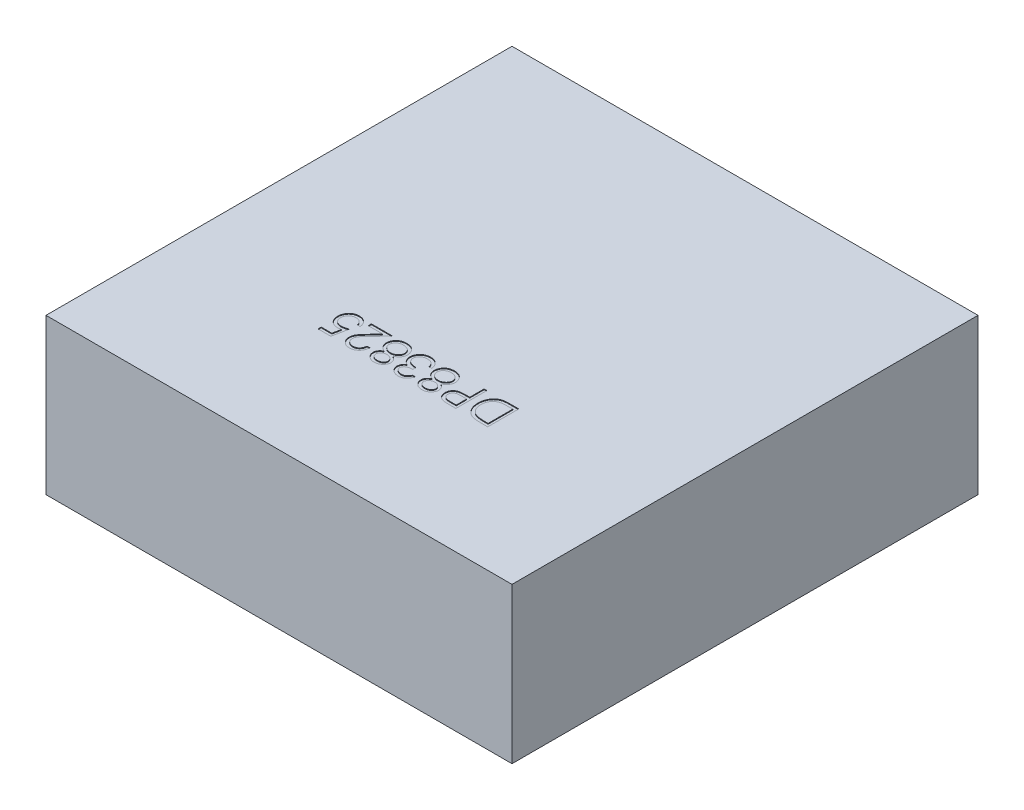
from build123d import *

# Parameters (mm, degrees)
BASES_W          = 3
BASES_H          = 3
BASE_DEPTH       = 1
PARTNUMBER_DEPTH = 0.005


with BuildPart() as part:
    # BaseS → Base (new body)
    with BuildSketch(Plane(origin=(0, 0, 0), x_dir=(1, 0, 0), z_dir=(0, 1, 0))):
        Rectangle(BASES_W, BASES_H)
    extrude(amount=BASE_DEPTH)

    # PartNumberS → PartNumber (cut)
    # profile 1 of 7: a face of its own
    with BuildSketch(Plane(origin=(0, 1, 0), x_dir=(1, 0, 0), z_dir=(0, 1, 0))):
        with BuildLine():
            Line((0.543589744, -0.5), (0.543589744, -0.7))
            Line((0.543589744, -0.7), (0.503205128, -0.7))
            add(Edge.make_bspline(
                [(0.503205128, -0.7), (0.499692607, -0.699974779), (0.492906435, -0.699926053), (0.483100107, -0.699615336), (0.474039691, -0.699071227), (0.46573033, -0.698263381), (0.458158677, -0.697293739), (0.451336857, -0.696060596), (0.445253815, -0.694610337), (0.441512712, -0.693373396), (0.43974359, -0.692788462)],
                knots=[0, 0, 0, 0, 1.314317071, 2.539253741, 3.67075822, 4.709970291, 5.662644612, 6.526156501, 7.303037452, 8, 8, 8, 8], degree=3))
            add(Edge.make_bspline(
                [(0.43974359, -0.692788462), (0.437429398, -0.691906981), (0.432853492, -0.690164008), (0.426341803, -0.686871104), (0.420190986, -0.683155356), (0.414449607, -0.678931575), (0.409105016, -0.674253735), (0.404089966, -0.669159683), (0.399548204, -0.663513427), (0.395323083, -0.657490166), (0.391625007, -0.651035088), (0.388364014, -0.644277488), (0.385579621, -0.637230477), (0.383407047, -0.629842637), (0.381612125, -0.622184924), (0.380407776, -0.614199361), (0.379607776, -0.605932503), (0.379527773, -0.600322461), (0.379487179, -0.597475962)],
                knots=[0, 0, 0, 0, 0.984696416, 1.947063185, 2.89840987, 3.841051395, 4.778753227, 5.721858861, 6.681155121, 7.65838316, 8.646299769, 9.637283673, 10.641736726, 11.657050558, 12.698485921, 13.768600492, 14.86780186, 16, 16, 16, 16], degree=3))
            add(Edge.make_bspline(
                [(0.379487179, -0.597475962), (0.379523145, -0.595003899), (0.379594018, -0.590132442), (0.380229632, -0.582952842), (0.381155261, -0.575986791), (0.382581759, -0.569264875), (0.384334606, -0.562741838), (0.386498066, -0.556448566), (0.389062316, -0.550380781), (0.392036117, -0.544586677), (0.395292309, -0.539080345), (0.398840463, -0.533949028), (0.402559095, -0.529136152), (0.40658383, -0.524750444), (0.410781412, -0.520655332), (0.415294606, -0.517032476), (0.419982101, -0.513713686), (0.424984721, -0.510799747), (0.430343511, -0.508207712), (0.436198451, -0.506018723), (0.442528171, -0.504134935), (0.449374613, -0.502634061), (0.456714945, -0.501424281), (0.464569063, -0.500618629), (0.472922261, -0.500072297), (0.478658238, -0.500024567), (0.481610577, -0.5)],
                knots=[0, 0, 0, 0, 1.105894396, 2.179280415, 3.222964075, 4.248423888, 5.251546139, 6.243661943, 7.223682738, 8.196462441, 9.155694589, 10.083899862, 10.986397372, 11.874737962, 12.745335529, 13.607670254, 14.461432187, 15.313100333, 16.195087267, 17.121790994, 18.106827133, 19.14775296, 20.255889161, 21.433815148, 22.679170477, 24, 24, 24, 24], degree=3))
            Line((0.481610577, -0.5), (0.543589744, -0.5))
        make_face()
        with BuildLine():
            Line((0.525641026, -0.520512821), (0.502684295, -0.520512821))
            add(Edge.make_bspline(
                [(0.502684295, -0.520512821), (0.499385531, -0.520526997), (0.493040799, -0.520554265), (0.483917485, -0.520793534), (0.47558152, -0.521184501), (0.468031719, -0.521731649), (0.461272346, -0.52245557), (0.455289275, -0.523262707), (0.450102117, -0.524268276), (0.446963292, -0.525179759), (0.445512821, -0.525600962)],
                knots=[0, 0, 0, 0, 1.375205317, 2.645023457, 3.804390687, 4.853969522, 5.800190428, 6.637939096, 7.370582563, 8, 8, 8, 8], degree=3))
            add(Edge.make_bspline(
                [(0.445512821, -0.525600962), (0.443687161, -0.52624386), (0.440079448, -0.5275143), (0.434886804, -0.529832576), (0.430041477, -0.532575274), (0.42546269, -0.535641994), (0.42117987, -0.539080089), (0.41721285, -0.542900492), (0.413530295, -0.547058974), (0.410191167, -0.551569547), (0.407171191, -0.556382165), (0.404561941, -0.561491465), (0.402362373, -0.566868777), (0.400557774, -0.572495393), (0.399150806, -0.57837466), (0.398160244, -0.584521333), (0.397546405, -0.590932984), (0.397473135, -0.595297753), (0.397435897, -0.597516026)],
                knots=[0, 0, 0, 0, 0.998420628, 1.972994, 2.929372424, 3.86770908, 4.81360496, 5.759023883, 6.706048443, 7.676227424, 8.651287839, 9.634325482, 10.632389399, 11.645655052, 12.680158286, 13.74837235, 14.855672678, 16, 16, 16, 16], degree=3))
            add(Edge.make_bspline(
                [(0.397435897, -0.597516026), (0.397465259, -0.599855068), (0.397522941, -0.604450136), (0.398246744, -0.61119266), (0.399306725, -0.61767655), (0.400831424, -0.623906472), (0.402801204, -0.629874323), (0.405158205, -0.635613817), (0.408019974, -0.641051094), (0.4112598, -0.646232204), (0.414897097, -0.651078684), (0.418915732, -0.655533753), (0.423273329, -0.659605711), (0.427949807, -0.663301041), (0.43301055, -0.666554027), (0.438369921, -0.669447832), (0.444103412, -0.671906581), (0.448092784, -0.673213849), (0.450120192, -0.673878205)],
                knots=[0, 0, 0, 0, 1.122272916, 2.204715076, 3.251197285, 4.274229216, 5.279697671, 6.265416158, 7.248880903, 8.225321784, 9.195852973, 10.153576302, 11.101466393, 12.055578741, 13.010401466, 13.985536859, 14.976245305, 16, 16, 16, 16], degree=3))
            add(Edge.make_bspline(
                [(0.450120192, -0.673878205), (0.451797401, -0.674342001), (0.455363606, -0.675328158), (0.461183004, -0.676403894), (0.467732441, -0.677352722), (0.475040995, -0.678156039), (0.483100336, -0.678732457), (0.491916661, -0.679165104), (0.501493781, -0.679456911), (0.508132783, -0.679476838), (0.511578526, -0.679487179)],
                knots=[0, 0, 0, 0, 0.674548936, 1.434276114, 2.292660221, 3.240891867, 4.284742987, 5.42552168, 6.663806718, 8, 8, 8, 8], degree=3))
            Line((0.511578526, -0.679487179), (0.525641026, -0.679487179))
            Line((0.525641026, -0.679487179), (0.525641026, -0.520512821))
        make_face(mode=Mode.SUBTRACT)
    # profile 2 of 7: a face of its own
    with BuildSketch(Plane(origin=(0, 1, 0), x_dir=(1, 0, 0), z_dir=(0, 1, 0))):
        with BuildLine():
            Line((0.338461538, -0.7), (0.299238782, -0.7))
            add(Edge.make_bspline(
                [(0.299238782, -0.7), (0.296541016, -0.699997035), (0.291371976, -0.699991352), (0.283959687, -0.699819081), (0.277227703, -0.699588985), (0.271190538, -0.699270019), (0.265829618, -0.698893071), (0.261169201, -0.698364383), (0.257172655, -0.697812366), (0.254778001, -0.697251143), (0.253685897, -0.696995192)],
                knots=[0, 0, 0, 0, 1.415646017, 2.712440637, 3.8905458, 4.950247383, 5.884950622, 6.709939814, 7.411656543, 8, 8, 8, 8], degree=3))
            add(Edge.make_bspline(
                [(0.253685897, -0.696995192), (0.252303419, -0.696616784), (0.249571037, -0.695868883), (0.245633708, -0.694371122), (0.241888245, -0.692594385), (0.238318984, -0.690572427), (0.234987068, -0.688209761), (0.231788469, -0.685642753), (0.228790266, -0.682767587), (0.226037732, -0.679588048), (0.22348739, -0.676208296), (0.221352571, -0.67254215), (0.219467441, -0.66871679), (0.217998343, -0.664638818), (0.216843575, -0.660362064), (0.216002557, -0.655875395), (0.215462016, -0.651188492), (0.215410725, -0.64798496), (0.215384615, -0.646354167)],
                knots=[0, 0, 0, 0, 0.999333726, 1.975119402, 2.933498163, 3.889020618, 4.832249799, 5.779334906, 6.747801194, 7.724875447, 8.710438469, 9.696133548, 10.679360639, 11.681339199, 12.714023775, 13.766351759, 14.862936069, 16, 16, 16, 16], degree=3))
            add(Edge.make_bspline(
                [(0.215384615, -0.646354167), (0.215408697, -0.644709722), (0.215455814, -0.641492256), (0.216021316, -0.636785239), (0.216783041, -0.632287046), (0.217954301, -0.628007648), (0.21948834, -0.623972462), (0.221287885, -0.62011982), (0.223458373, -0.616515267), (0.225952363, -0.613145717), (0.22872674, -0.610008008), (0.231769765, -0.607124877), (0.235069153, -0.604513201), (0.238614419, -0.602167124), (0.242440124, -0.600141051), (0.246488247, -0.598326348), (0.250793974, -0.596802287), (0.253773546, -0.596000569), (0.255288462, -0.595592949)],
                knots=[0, 0, 0, 0, 1.121902311, 2.195077645, 3.232258892, 4.234102512, 5.217864754, 6.176164875, 7.132989551, 8.084763148, 9.034132444, 9.988522005, 10.94243251, 11.903244335, 12.886203696, 13.894208494, 14.929344452, 16, 16, 16, 16], degree=3))
            add(Edge.make_bspline(
                [(0.255288462, -0.595592949), (0.256541466, -0.595326691), (0.259287499, -0.594743172), (0.263809657, -0.594087314), (0.269077464, -0.593549438), (0.275072997, -0.593047488), (0.281810237, -0.592781517), (0.289273732, -0.592469224), (0.297488742, -0.59232187), (0.303218455, -0.592312555), (0.306209936, -0.592307692)],
                knots=[0, 0, 0, 0, 0.601372724, 1.317943291, 2.144091499, 3.08771165, 4.142394186, 5.309582461, 6.595334295, 8, 8, 8, 8], degree=3))
            Line((0.306209936, -0.592307692), (0.320512821, -0.592307692))
            Line((0.320512821, -0.592307692), (0.320512821, -0.5))
            Line((0.320512821, -0.5), (0.338461538, -0.5))
            Line((0.338461538, -0.5), (0.338461538, -0.7))
        make_face()
        with BuildLine():
            Line((0.320512821, -0.679487179), (0.320512821, -0.612820513))
            Line((0.320512821, -0.612820513), (0.285496795, -0.612379808))
            add(Edge.make_bspline(
                [(0.285496795, -0.612379808), (0.283787056, -0.61237868), (0.28048644, -0.612376504), (0.275705726, -0.612608136), (0.271281004, -0.612860126), (0.267205742, -0.613267653), (0.26349854, -0.613764708), (0.260150423, -0.614429274), (0.25713467, -0.615107089), (0.253660857, -0.616283217), (0.249769822, -0.618057557), (0.245546671, -0.620707753), (0.241938335, -0.624046335), (0.238842209, -0.627840667), (0.236394934, -0.632066148), (0.234621287, -0.636574615), (0.233538689, -0.641348947), (0.233402616, -0.644612418), (0.233333333, -0.646274038)],
                knots=[0, 0, 0, 0, 1.160501667, 2.240324542, 3.248665471, 4.168823117, 5.020172044, 5.786515869, 6.485785279, 7.116517804, 8.272762037, 9.381837012, 10.485674779, 11.594342068, 12.695271952, 13.786226926, 14.872841088, 16, 16, 16, 16], degree=3))
            add(Edge.make_bspline(
                [(0.233333333, -0.646274038), (0.233405707, -0.647881827), (0.233549577, -0.651077912), (0.234612344, -0.655764279), (0.236413717, -0.660221491), (0.238844205, -0.664413482), (0.241866136, -0.668197729), (0.24540271, -0.671461906), (0.249398902, -0.674103874), (0.253087222, -0.675862608), (0.256387977, -0.676893968), (0.25924118, -0.677638558), (0.262479129, -0.678152086), (0.26607118, -0.678643436), (0.270012736, -0.679040062), (0.274328858, -0.679315492), (0.279005171, -0.679474996), (0.282251474, -0.67948302), (0.283934295, -0.679487179)],
                knots=[0, 0, 0, 0, 1.12039168, 2.227199994, 3.330242575, 4.460839274, 5.593542475, 6.693949254, 7.801736126, 8.92216649, 9.528704869, 10.210659466, 10.975987387, 11.81211542, 12.738540127, 13.736887663, 14.826846554, 16, 16, 16, 16], degree=3))
            Line((0.283934295, -0.679487179), (0.320512821, -0.679487179))
        make_face(mode=Mode.SUBTRACT)
    # profile 3 of 7: a face of its own
    with BuildSketch(Plane(origin=(0, 1, 0), x_dir=(1, 0, 0), z_dir=(0, 1, 0))):
        with BuildLine():
            add(Edge.make_bspline(
                [(0.095072115, -0.611418269), (0.093448086, -0.610564826), (0.09027078, -0.60889512), (0.085744586, -0.606198493), (0.081520102, -0.60345477), (0.077675464, -0.600565302), (0.074172977, -0.597591509), (0.071001864, -0.594541261), (0.068128021, -0.591424203), (0.065650177, -0.588160203), (0.063451692, -0.584807304), (0.061589306, -0.581324182), (0.059963915, -0.577761169), (0.058688187, -0.574064171), (0.057634926, -0.570283906), (0.056910765, -0.566369649), (0.056521184, -0.56234771), (0.056447543, -0.559629518), (0.056410256, -0.558253205)],
                knots=[0, 0, 0, 0, 1.264219729, 2.473363326, 3.62979159, 4.734286947, 5.785533755, 6.79450939, 7.765315851, 8.704182021, 9.615576613, 10.525715488, 11.423813905, 12.311666436, 13.218214638, 14.126256791, 15.051260205, 16, 16, 16, 16], degree=3))
            add(Edge.make_bspline(
                [(0.056410256, -0.558253205), (0.056454091, -0.556327537), (0.056540855, -0.552515919), (0.057304446, -0.546891633), (0.058432371, -0.54140719), (0.060145798, -0.536124764), (0.06225425, -0.530999346), (0.064914839, -0.52609999), (0.067917657, -0.521286058), (0.070332554, -0.518325141), (0.071554487, -0.516826923)],
                knots=[0, 0, 0, 0, 1.02531512, 2.029483338, 3.018748588, 4.004195107, 4.983200899, 5.966616707, 6.971112471, 8, 8, 8, 8], degree=3))
            add(Edge.make_bspline(
                [(0.071554487, -0.516826923), (0.073145143, -0.515078707), (0.076306798, -0.511603879), (0.081722965, -0.507092404), (0.087667073, -0.50330101), (0.094116121, -0.500211188), (0.101052869, -0.497806282), (0.108475841, -0.496078138), (0.116399507, -0.495088285), (0.121845534, -0.4949452), (0.124639423, -0.494871795)],
                knots=[0, 0, 0, 0, 0.954267603, 1.896743057, 2.838368354, 3.796610408, 4.779680527, 5.799409237, 6.871065594, 8, 8, 8, 8], degree=3))
            add(Edge.make_bspline(
                [(0.124639423, -0.494871795), (0.127325841, -0.494937827), (0.132553336, -0.49506632), (0.140163209, -0.49593214), (0.147265419, -0.497464973), (0.153893637, -0.499519585), (0.159983771, -0.502259459), (0.165546895, -0.505617745), (0.170664546, -0.509518623), (0.175176177, -0.514055973), (0.179180498, -0.518916859), (0.182701081, -0.523930136), (0.185610833, -0.529092156), (0.188118805, -0.534324398), (0.189985223, -0.539732879), (0.19130901, -0.545262095), (0.192140532, -0.550896339), (0.192251744, -0.554698039), (0.192307692, -0.556610577)],
                knots=[0, 0, 0, 0, 1.256864279, 2.445730223, 3.576845088, 4.651810441, 5.686528262, 6.692706664, 7.686234615, 8.689148594, 9.678739427, 10.630299996, 11.55097961, 12.448208961, 13.341360817, 14.221834469, 15.105450545, 16, 16, 16, 16], degree=3))
            add(Edge.make_bspline(
                [(0.192307692, -0.556610577), (0.192274662, -0.558013956), (0.192209384, -0.560787529), (0.191757795, -0.56488525), (0.191031164, -0.568873432), (0.190046512, -0.572767815), (0.188699829, -0.57654785), (0.187102182, -0.580233033), (0.185221368, -0.583823256), (0.182983326, -0.587263859), (0.180517583, -0.590676716), (0.177590521, -0.593892364), (0.174397283, -0.597099685), (0.170747775, -0.600103642), (0.166839098, -0.603152404), (0.162488961, -0.605991149), (0.157842414, -0.608841427), (0.15453909, -0.610544584), (0.152844551, -0.611418269)],
                knots=[0, 0, 0, 0, 0.941575622, 1.860885767, 2.762557628, 3.660168386, 4.552890429, 5.45184204, 6.353736508, 7.268493418, 8.204037487, 9.175167802, 10.182660057, 11.238220596, 12.344046335, 13.507168087, 14.721227736, 16, 16, 16, 16], degree=3))
            add(Edge.make_bspline(
                [(0.152844551, -0.611418269), (0.155161235, -0.612686787), (0.159639967, -0.615139152), (0.165626949, -0.619588623), (0.170698429, -0.624494994), (0.174800511, -0.629865647), (0.178039312, -0.635524067), (0.180329181, -0.641440467), (0.181823831, -0.647548858), (0.181975241, -0.651714174), (0.182051282, -0.65380609)],
                knots=[0, 0, 0, 0, 1.16701039, 2.256125286, 3.287752239, 4.277689688, 5.235169525, 6.160862735, 7.076343936, 8, 8, 8, 8], degree=3))
            add(Edge.make_bspline(
                [(0.182051282, -0.65380609), (0.181957663, -0.65593728), (0.181769474, -0.660221345), (0.180252979, -0.666600352), (0.177762975, -0.672868993), (0.17443421, -0.679012741), (0.170197946, -0.68475165), (0.165183735, -0.68994045), (0.159397884, -0.694444849), (0.152967566, -0.698252547), (0.146060008, -0.701366404), (0.138759626, -0.703492187), (0.131196531, -0.704890317), (0.126047994, -0.705048169), (0.1234375, -0.705128205)],
                knots=[0, 0, 0, 0, 0.888724595, 1.786491426, 2.720083884, 3.697804067, 4.69440576, 5.687697823, 6.7000873, 7.744853364, 8.800284131, 9.853047784, 10.91141782, 12, 12, 12, 12], degree=3))
            add(Edge.make_bspline(
                [(0.1234375, -0.705128205), (0.12089433, -0.705045914), (0.115879488, -0.704883645), (0.108497178, -0.703516914), (0.101427646, -0.701259841), (0.094710514, -0.698185699), (0.088488708, -0.694355228), (0.082951877, -0.689801259), (0.078054821, -0.684668997), (0.074008968, -0.67891116), (0.07076334, -0.672767821), (0.068426113, -0.666395151), (0.0669485, -0.659869548), (0.066760739, -0.65545632), (0.066666667, -0.653245192)],
                knots=[0, 0, 0, 0, 1.072634126, 2.115112298, 3.156050586, 4.19761425, 5.225177188, 6.230426315, 7.215180151, 8.209739481, 9.190420596, 10.139012357, 11.067603024, 12, 12, 12, 12], degree=3))
            add(Edge.make_bspline(
                [(0.066666667, -0.653245192), (0.066749137, -0.651075288), (0.066911105, -0.646813718), (0.068255664, -0.640610289), (0.070555277, -0.63481268), (0.073657461, -0.629331678), (0.077729149, -0.62425487), (0.082688129, -0.619557042), (0.088470053, -0.615146315), (0.092822236, -0.612688729), (0.095072115, -0.611418269)],
                knots=[0, 0, 0, 0, 0.975463758, 1.915755378, 2.838359076, 3.772025586, 4.738400888, 5.753889765, 6.838863581, 8, 8, 8, 8], degree=3))
        make_face()
        with BuildLine():
            add(Edge.make_bspline(
                [(0.124439103, -0.684615385), (0.125842055, -0.68457828), (0.128586843, -0.684505687), (0.132610652, -0.684123506), (0.136440115, -0.683389395), (0.140096173, -0.682383673), (0.143591352, -0.681132354), (0.146845499, -0.679483698), (0.149967974, -0.67765121), (0.152856339, -0.675501785), (0.155471044, -0.673156716), (0.157806436, -0.670707661), (0.159709055, -0.668082423), (0.161345949, -0.665412338), (0.162561571, -0.662586659), (0.163425107, -0.659667255), (0.164036238, -0.656635634), (0.164080284, -0.654570362), (0.164102564, -0.653525641)],
                knots=[0, 0, 0, 0, 1.20353747, 2.354645537, 3.462130888, 4.543058862, 5.604822423, 6.639552563, 7.666902586, 8.706944258, 9.720926464, 10.677177239, 11.602682187, 12.496457588, 13.358248655, 14.231532794, 15.105417644, 16, 16, 16, 16], degree=3))
            add(Edge.make_bspline(
                [(0.164102564, -0.653525641), (0.16406193, -0.652481511), (0.16398163, -0.65041816), (0.163400418, -0.647358955), (0.162428627, -0.644391821), (0.161096092, -0.641489058), (0.159386034, -0.638658118), (0.157310533, -0.635888153), (0.154779535, -0.633252413), (0.15198455, -0.630676115), (0.148931523, -0.628302534), (0.145723347, -0.626182322), (0.142336608, -0.624492107), (0.138872732, -0.623010134), (0.135258466, -0.621898483), (0.13151873, -0.621097603), (0.127657519, -0.620602209), (0.125041531, -0.620542853), (0.123717949, -0.620512821)],
                knots=[0, 0, 0, 0, 0.873213166, 1.72559466, 2.594724523, 3.479581045, 4.391597569, 5.35687048, 6.368548091, 7.443976143, 8.534559525, 9.600545123, 10.654815915, 11.696401765, 12.749428718, 13.812189468, 14.893058657, 16, 16, 16, 16], degree=3))
            add(Edge.make_bspline(
                [(0.123717949, -0.620512821), (0.122017841, -0.620562447), (0.118634417, -0.62066121), (0.113648532, -0.621587854), (0.108788446, -0.623027019), (0.10414612, -0.625069654), (0.099804641, -0.627560117), (0.095886456, -0.630497069), (0.092555535, -0.633949484), (0.089721768, -0.637717094), (0.087506164, -0.641713618), (0.085808977, -0.645740643), (0.084809483, -0.649831338), (0.084679557, -0.652572418), (0.084615385, -0.653926282)],
                knots=[0, 0, 0, 0, 1.076561449, 2.142489767, 3.202892658, 4.283174188, 5.348766409, 6.369549039, 7.375093932, 8.378927502, 9.349008457, 10.26378795, 11.142457041, 12, 12, 12, 12], degree=3))
            add(Edge.make_bspline(
                [(0.084615385, -0.653926282), (0.084645217, -0.654876655), (0.084704429, -0.656763008), (0.085212138, -0.659557766), (0.086004009, -0.662290685), (0.087158273, -0.664945724), (0.088554573, -0.667584561), (0.090334402, -0.670124414), (0.092397123, -0.672642144), (0.094772513, -0.675054881), (0.097456214, -0.677320023), (0.100469934, -0.679283546), (0.10378708, -0.680920906), (0.107363178, -0.682296491), (0.111236022, -0.683318149), (0.115372266, -0.684086984), (0.119809232, -0.684519435), (0.12286234, -0.684582708), (0.124439103, -0.684615385)],
                knots=[0, 0, 0, 0, 0.814035228, 1.61574325, 2.427118093, 3.24780647, 4.092880925, 4.981933388, 5.900917883, 6.880367106, 7.87994501, 8.905470125, 9.95492938, 11.0455354, 12.184050453, 13.382997595, 14.64846247, 16, 16, 16, 16], degree=3))
        make_face(mode=Mode.SUBTRACT)
        with BuildLine():
            add(Edge.make_bspline(
                [(0.123277244, -0.6), (0.125055855, -0.599968354), (0.128545057, -0.599906273), (0.13365695, -0.599215573), (0.138562594, -0.598253427), (0.143246929, -0.596796207), (0.147685909, -0.594900166), (0.151942005, -0.592651786), (0.155948568, -0.58995688), (0.159687689, -0.586880797), (0.163110956, -0.58354732), (0.166125189, -0.580026723), (0.168671789, -0.576366811), (0.170738384, -0.572562955), (0.172341593, -0.568623537), (0.173524787, -0.564546257), (0.174211747, -0.560319741), (0.174309625, -0.557454335), (0.174358974, -0.556009615)],
                knots=[0, 0, 0, 0, 1.140332253, 2.237053636, 3.304055028, 4.344690294, 5.377465719, 6.397042765, 7.428360044, 8.469453732, 9.499453352, 10.490108612, 11.438398528, 12.354680514, 13.261581007, 14.161901135, 15.073242693, 16, 16, 16, 16], degree=3))
            add(Edge.make_bspline(
                [(0.174358974, -0.556009615), (0.174279634, -0.554213877), (0.174121649, -0.550638134), (0.17291325, -0.545366854), (0.17092871, -0.540265191), (0.168144634, -0.535405096), (0.164748712, -0.530845496), (0.160620307, -0.526815098), (0.155860072, -0.523368157), (0.150507117, -0.520487221), (0.14463923, -0.518205481), (0.138292673, -0.516573052), (0.131510437, -0.515547001), (0.12683336, -0.515439597), (0.124439103, -0.515384615)],
                knots=[0, 0, 0, 0, 0.899105568, 1.790333855, 2.694925079, 3.632758987, 4.588257081, 5.534574046, 6.511571685, 7.523527334, 8.572244311, 9.657983075, 10.801090915, 12, 12, 12, 12], degree=3))
            add(Edge.make_bspline(
                [(0.124439103, -0.515384615), (0.122567783, -0.515420967), (0.118921852, -0.515491791), (0.113600858, -0.51610394), (0.108591274, -0.51710387), (0.103845107, -0.518459669), (0.099397684, -0.520256898), (0.095255066, -0.52248923), (0.091360842, -0.525039034), (0.087881445, -0.528057783), (0.084717817, -0.531288031), (0.081946728, -0.534689588), (0.079601535, -0.538228389), (0.077711084, -0.541902361), (0.076209885, -0.545698003), (0.075127692, -0.549630896), (0.074460706, -0.553716489), (0.074393195, -0.556487844), (0.074358974, -0.557892628)],
                knots=[0, 0, 0, 0, 1.224631902, 2.385975653, 3.500340538, 4.565441647, 5.612488581, 6.63322211, 7.641830068, 8.652595074, 9.641693811, 10.598750962, 11.520088299, 12.415429315, 13.298523938, 14.187139574, 15.081071174, 16, 16, 16, 16], degree=3))
            add(Edge.make_bspline(
                [(0.074358974, -0.557892628), (0.074410395, -0.559257203), (0.074511788, -0.561947906), (0.075164559, -0.565932312), (0.07628515, -0.569797522), (0.077919162, -0.573526106), (0.079925811, -0.577161434), (0.082404663, -0.580672989), (0.085325505, -0.584070494), (0.088681189, -0.587283997), (0.092317992, -0.590254735), (0.09617221, -0.592894765), (0.100261406, -0.595052486), (0.104504576, -0.596865123), (0.108944495, -0.598277723), (0.113559747, -0.599268256), (0.118359076, -0.599890806), (0.121619333, -0.599963191), (0.123277244, -0.6)],
                knots=[0, 0, 0, 0, 0.917336384, 1.808827106, 2.706624561, 3.615530867, 4.539869921, 5.493819324, 6.499753197, 7.547410123, 8.613069608, 9.653934021, 10.682176708, 11.716048074, 12.752411263, 13.808993382, 14.885826486, 16, 16, 16, 16], degree=3))
        make_face(mode=Mode.SUBTRACT)
    # profile 4 of 7: a face of its own
    with BuildSketch(Plane(origin=(0, 1, 0), x_dir=(1, 0, 0), z_dir=(0, 1, 0))):
        with BuildLine():
            Line((0.012820513, -0.653846154), (0.030769231, -0.653846154))
            add(Edge.make_bspline(
                [(0.030769231, -0.653846154), (0.030282971, -0.655859439), (0.029332372, -0.659795246), (0.027349654, -0.665418518), (0.025189696, -0.670739862), (0.022596033, -0.675659638), (0.019766961, -0.680276718), (0.016525663, -0.684486382), (0.013021679, -0.688395694), (0.009145968, -0.691865022), (0.005081473, -0.695006607), (0.000770923, -0.697685181), (-0.003698957, -0.699989419), (-0.008359136, -0.701887718), (-0.013223488, -0.703317748), (-0.018248038, -0.704355279), (-0.023445953, -0.705029057), (-0.026974386, -0.705094815), (-0.028766026, -0.705128205)],
                knots=[0, 0, 0, 0, 1.162005537, 2.271625781, 3.343758855, 4.383309926, 5.390229558, 6.379919256, 7.361854164, 8.333198761, 9.295911338, 10.242430842, 11.177959212, 12.116337295, 13.062827104, 14.020064771, 14.994644689, 16, 16, 16, 16], degree=3))
            add(Edge.make_bspline(
                [(-0.028766026, -0.705128205), (-0.031376468, -0.705049392), (-0.036540412, -0.704893485), (-0.044126871, -0.703469803), (-0.05144269, -0.701216938), (-0.058407789, -0.698104154), (-0.064877414, -0.694264879), (-0.070633768, -0.689695465), (-0.075598825, -0.684484076), (-0.079764218, -0.67872793), (-0.083025647, -0.672576186), (-0.085430583, -0.666244749), (-0.086894679, -0.659748636), (-0.087084425, -0.655362506), (-0.087179487, -0.653165064)],
                knots=[0, 0, 0, 0, 1.083050992, 2.142477498, 3.193116406, 4.255571735, 5.30263384, 6.308962982, 7.297363603, 8.282367274, 9.249857812, 10.179914175, 11.08814088, 12, 12, 12, 12], degree=3))
            add(Edge.make_bspline(
                [(-0.087179487, -0.653165064), (-0.087112996, -0.65105039), (-0.086982884, -0.646912301), (-0.085878101, -0.640871073), (-0.084018886, -0.635177267), (-0.081443471, -0.629806915), (-0.078109668, -0.624794067), (-0.074071228, -0.620127445), (-0.069299647, -0.61578635), (-0.065683708, -0.613299523), (-0.063822115, -0.612019231)],
                knots=[0, 0, 0, 0, 1.024540389, 2.004866551, 2.965041327, 3.920577974, 4.882998113, 5.874504559, 6.905732034, 8, 8, 8, 8], degree=3))
            add(Edge.make_bspline(
                [(-0.063822115, -0.612019231), (-0.065952356, -0.610995631), (-0.070179819, -0.608964297), (-0.0758839, -0.604917242), (-0.081140957, -0.600359254), (-0.084038259, -0.596762548), (-0.085496795, -0.594951923)],
                knots=[0, 0, 0, 0, 1.015663554, 2.015584519, 3.001021554, 4, 4, 4, 4], degree=3))
            add(Edge.make_bspline(
                [(-0.085496795, -0.594951923), (-0.086459549, -0.593634478), (-0.088369292, -0.591021161), (-0.090719885, -0.586817028), (-0.092876712, -0.582580215), (-0.094464075, -0.578144135), (-0.095833906, -0.573651284), (-0.09673521, -0.569005451), (-0.09731381, -0.564250776), (-0.097395058, -0.561032679), (-0.097435897, -0.559415064)],
                knots=[0, 0, 0, 0, 1.02516404, 2.033540309, 3.025129118, 4.011046665, 4.991655828, 5.976607087, 6.982917762, 8, 8, 8, 8], degree=3))
            add(Edge.make_bspline(
                [(-0.097435897, -0.559415064), (-0.097333113, -0.556614634), (-0.097128029, -0.551026954), (-0.095302832, -0.54276937), (-0.092455757, -0.534712452), (-0.088487886, -0.526970463), (-0.083556422, -0.519748905), (-0.07772183, -0.513268976), (-0.070977897, -0.507749819), (-0.063520977, -0.503097513), (-0.055410893, -0.499410613), (-0.046770987, -0.496753903), (-0.037652414, -0.49516025), (-0.031416635, -0.494969041), (-0.028245192, -0.494871795)],
                knots=[0, 0, 0, 0, 0.955619592, 1.906742024, 2.874954321, 3.868585453, 4.869520953, 5.854611167, 6.836527075, 7.836578462, 8.849204403, 9.870874567, 10.917152508, 12, 12, 12, 12], degree=3))
            add(Edge.make_bspline(
                [(-0.028245192, -0.494871795), (-0.026107081, -0.49492184), (-0.021899991, -0.495020311), (-0.015712732, -0.495681497), (-0.009819218, -0.496921931), (-0.004162223, -0.498481947), (0.001172877, -0.500638844), (0.006262821, -0.503210266), (0.0110853, -0.506262151), (0.015611673, -0.509799634), (0.019837104, -0.513759317), (0.023653945, -0.518206982), (0.027104423, -0.523059619), (0.030166616, -0.52836088), (0.03285341, -0.534095915), (0.035106986, -0.540287707), (0.037074636, -0.546888254), (0.037991249, -0.551486777), (0.038461538, -0.553846154)],
                knots=[0, 0, 0, 0, 1.048603596, 2.063302207, 3.045874044, 3.999447474, 4.937100059, 5.862643889, 6.7929026, 7.7308982, 8.676022965, 9.627908155, 10.600123445, 11.591992905, 12.626222643, 13.701663232, 14.820785756, 16, 16, 16, 16], degree=3))
            Line((0.038461538, -0.553846154), (0.020512821, -0.553846154))
            add(Edge.make_bspline(
                [(0.020512821, -0.553846154), (0.020045204, -0.55230621), (0.019135649, -0.549310886), (0.017587403, -0.545000012), (0.015823502, -0.541048123), (0.013931241, -0.53742623), (0.011943902, -0.534098664), (0.009720192, -0.531153415), (0.007424812, -0.528461117), (0.005694563, -0.526944282), (0.004847756, -0.526201923)],
                knots=[0, 0, 0, 0, 1.198163088, 2.33053128, 3.407730985, 4.417276592, 5.372219308, 6.28897303, 7.162600585, 8, 8, 8, 8], degree=3))
            add(Edge.make_bspline(
                [(0.004847756, -0.526201923), (0.003727827, -0.525338946), (0.001491425, -0.523615655), (-0.002150597, -0.521410219), (-0.005994289, -0.519522419), (-0.010071706, -0.517987935), (-0.014383394, -0.516836097), (-0.018911864, -0.516007058), (-0.023664545, -0.515459763), (-0.026908156, -0.51541003), (-0.028565705, -0.515384615)],
                knots=[0, 0, 0, 0, 0.946083416, 1.889246487, 2.84504177, 3.809995578, 4.801312957, 5.829064617, 6.89060985, 8, 8, 8, 8], degree=3))
            add(Edge.make_bspline(
                [(-0.028565705, -0.515384615), (-0.030437359, -0.515419753), (-0.034097217, -0.515488461), (-0.039437141, -0.516122158), (-0.044518831, -0.517041039), (-0.049290429, -0.518478347), (-0.053816865, -0.520202635), (-0.057997096, -0.522460045), (-0.061954014, -0.525009425), (-0.065571702, -0.527974844), (-0.068833224, -0.531180141), (-0.071651539, -0.534580675), (-0.074092522, -0.538071008), (-0.076054666, -0.541732562), (-0.077606813, -0.545529421), (-0.078662813, -0.549475795), (-0.079397234, -0.553538455), (-0.079457034, -0.556300116), (-0.079487179, -0.557692308)],
                knots=[0, 0, 0, 0, 1.216990249, 2.379719373, 3.493992396, 4.571561497, 5.616923107, 6.638958652, 7.655775068, 8.674704564, 9.676001865, 10.625896028, 11.54399481, 12.441854662, 13.322657739, 14.20572845, 15.095482574, 16, 16, 16, 16], degree=3))
            add(Edge.make_bspline(
                [(-0.079487179, -0.557692308), (-0.079399551, -0.559555696), (-0.079224731, -0.5632732), (-0.077895545, -0.568744529), (-0.075689671, -0.574018171), (-0.072661586, -0.579025064), (-0.068887132, -0.583611196), (-0.064544725, -0.58771628), (-0.059541713, -0.591134393), (-0.054910874, -0.593489428), (-0.050798365, -0.595058495), (-0.047286074, -0.596158774), (-0.043350443, -0.597038296), (-0.03903876, -0.597889066), (-0.034332829, -0.598602295), (-0.029228414, -0.599199653), (-0.02372346, -0.599676883), (-0.019912544, -0.599890117), (-0.017948718, -0.6)],
                knots=[0, 0, 0, 0, 1.070440979, 2.135555593, 3.216243406, 4.345886539, 5.486149072, 6.621334998, 7.769144672, 8.957074012, 9.598644492, 10.297969361, 11.070758978, 11.915404831, 12.824182859, 13.805940418, 14.869366021, 16, 16, 16, 16], degree=3))
            Line((-0.017948718, -0.6), (-0.017948718, -0.620512821))
            add(Edge.make_bspline(
                [(-0.017948718, -0.620512821), (-0.020422108, -0.620561043), (-0.025265177, -0.620655467), (-0.03235955, -0.62156233), (-0.039122704, -0.623034295), (-0.045452911, -0.625089351), (-0.051192825, -0.627591218), (-0.056220175, -0.630392354), (-0.060354102, -0.633623909), (-0.063668643, -0.637133123), (-0.066127074, -0.640920736), (-0.067941743, -0.644850479), (-0.069015081, -0.648995461), (-0.06915862, -0.651823627), (-0.069230769, -0.653245192)],
                knots=[0, 0, 0, 0, 1.321816535, 2.58820849, 3.816448615, 5.017641336, 6.139869627, 7.160068286, 8.085608132, 8.934319198, 9.728416342, 10.48890201, 11.240453369, 12, 12, 12, 12], degree=3))
            add(Edge.make_bspline(
                [(-0.069230769, -0.653245192), (-0.06920761, -0.654289811), (-0.069161535, -0.656368031), (-0.068557263, -0.659413745), (-0.067691186, -0.662366392), (-0.066432952, -0.665191473), (-0.064805673, -0.667897968), (-0.062836907, -0.670495763), (-0.060521668, -0.673009663), (-0.05787499, -0.675384225), (-0.05492123, -0.677521373), (-0.051778939, -0.679426611), (-0.048435869, -0.681028645), (-0.044913803, -0.682356622), (-0.041193704, -0.683353822), (-0.037295143, -0.684070288), (-0.033210105, -0.684518117), (-0.030423153, -0.684582603), (-0.02900641, -0.684615385)],
                knots=[0, 0, 0, 0, 0.884246871, 1.759167212, 2.622361933, 3.489113179, 4.372562419, 5.294145153, 6.247651513, 7.265905295, 8.30305477, 9.334068495, 10.37719476, 11.441246459, 12.52060732, 13.637552802, 14.799054011, 16, 16, 16, 16], degree=3))
            add(Edge.make_bspline(
                [(-0.02900641, -0.684615385), (-0.026729097, -0.684536032), (-0.022280974, -0.684381039), (-0.015869742, -0.683018718), (-0.009915786, -0.680860261), (-0.005380072, -0.678253931), (-0.002025058, -0.67569), (0.000418369, -0.67348425), (0.002774082, -0.670983381), (0.004949643, -0.668118798), (0.007075414, -0.664989002), (0.009131098, -0.661576754), (0.011050666, -0.657833407), (0.012219139, -0.655200978), (0.012820513, -0.653846154)],
                knots=[0, 0, 0, 0, 1.4727372, 2.876598283, 4.222346151, 5.558423782, 6.24313385, 6.953189256, 7.68715613, 8.463578749, 9.278833271, 10.135787152, 11.040551781, 12, 12, 12, 12], degree=3))
        make_face()
    # profile 5 of 7: a face of its own
    with BuildSketch(Plane(origin=(0, 1, 0), x_dir=(1, 0, 0), z_dir=(0, 1, 0))):
        with BuildLine():
            add(Edge.make_bspline(
                [(-0.212620192, -0.611418269), (-0.214244221, -0.610564826), (-0.217421528, -0.60889512), (-0.221947722, -0.606198493), (-0.226172205, -0.60345477), (-0.230016844, -0.600565302), (-0.233519331, -0.597591509), (-0.236690444, -0.594541261), (-0.239564287, -0.591424203), (-0.242042131, -0.588160203), (-0.244240616, -0.584807304), (-0.246103002, -0.581324182), (-0.247728392, -0.577761169), (-0.249004121, -0.574064171), (-0.250057382, -0.570283906), (-0.250781543, -0.566369649), (-0.251171124, -0.56234771), (-0.251244765, -0.559629518), (-0.251282051, -0.558253205)],
                knots=[0, 0, 0, 0, 1.264219729, 2.473363326, 3.62979159, 4.734286947, 5.785533755, 6.79450939, 7.765315851, 8.704182021, 9.615576613, 10.525715488, 11.423813905, 12.311666436, 13.218214638, 14.126256791, 15.051260205, 16, 16, 16, 16], degree=3))
            add(Edge.make_bspline(
                [(-0.251282051, -0.558253205), (-0.251238217, -0.556327537), (-0.251151453, -0.552515919), (-0.250387862, -0.546891633), (-0.249259937, -0.54140719), (-0.24754651, -0.536124764), (-0.245438058, -0.530999346), (-0.242777469, -0.52609999), (-0.23977465, -0.521286058), (-0.237359753, -0.518325141), (-0.236137821, -0.516826923)],
                knots=[0, 0, 0, 0, 1.02531512, 2.029483338, 3.018748588, 4.004195107, 4.983200899, 5.966616707, 6.971112471, 8, 8, 8, 8], degree=3))
            add(Edge.make_bspline(
                [(-0.236137821, -0.516826923), (-0.234547165, -0.515078707), (-0.23138551, -0.511603879), (-0.225969342, -0.507092404), (-0.220025235, -0.50330101), (-0.213576187, -0.500211188), (-0.206639438, -0.497806282), (-0.199216467, -0.496078138), (-0.191292801, -0.495088285), (-0.185846774, -0.4949452), (-0.183052885, -0.494871795)],
                knots=[0, 0, 0, 0, 0.954267603, 1.896743057, 2.838368354, 3.796610408, 4.779680527, 5.799409237, 6.871065594, 8, 8, 8, 8], degree=3))
            add(Edge.make_bspline(
                [(-0.183052885, -0.494871795), (-0.180366467, -0.494937827), (-0.175138972, -0.49506632), (-0.167529098, -0.49593214), (-0.160426889, -0.497464973), (-0.153798671, -0.499519585), (-0.147708536, -0.502259459), (-0.142145413, -0.505617745), (-0.137027762, -0.509518623), (-0.132516131, -0.514055973), (-0.12851181, -0.518916859), (-0.124991226, -0.523930136), (-0.122081475, -0.529092156), (-0.119573503, -0.534324398), (-0.117707085, -0.539732879), (-0.116383298, -0.545262095), (-0.115551775, -0.550896339), (-0.115440563, -0.554698039), (-0.115384615, -0.556610577)],
                knots=[0, 0, 0, 0, 1.256864279, 2.445730223, 3.576845088, 4.651810441, 5.686528262, 6.692706664, 7.686234615, 8.689148594, 9.678739427, 10.630299996, 11.55097961, 12.448208961, 13.341360817, 14.221834469, 15.105450545, 16, 16, 16, 16], degree=3))
            add(Edge.make_bspline(
                [(-0.115384615, -0.556610577), (-0.115417645, -0.558013956), (-0.115482924, -0.560787529), (-0.115934513, -0.56488525), (-0.116661144, -0.568873432), (-0.117645796, -0.572767815), (-0.118992479, -0.57654785), (-0.120590126, -0.580233033), (-0.12247094, -0.583823256), (-0.124708982, -0.587263859), (-0.127174724, -0.590676716), (-0.130101787, -0.593892364), (-0.133295025, -0.597099685), (-0.136944533, -0.600103642), (-0.140853209, -0.603152404), (-0.145203347, -0.605991149), (-0.149849894, -0.608841427), (-0.153153218, -0.610544584), (-0.154847756, -0.611418269)],
                knots=[0, 0, 0, 0, 0.941575622, 1.860885767, 2.762557628, 3.660168386, 4.552890429, 5.45184204, 6.353736508, 7.268493418, 8.204037487, 9.175167802, 10.182660057, 11.238220596, 12.344046335, 13.507168087, 14.721227736, 16, 16, 16, 16], degree=3))
            add(Edge.make_bspline(
                [(-0.154847756, -0.611418269), (-0.152531073, -0.612686787), (-0.14805234, -0.615139152), (-0.142065358, -0.619588623), (-0.136993879, -0.624494994), (-0.132891797, -0.629865647), (-0.129652996, -0.635524067), (-0.127363126, -0.641440467), (-0.125868476, -0.647548858), (-0.125717067, -0.651714174), (-0.125641026, -0.65380609)],
                knots=[0, 0, 0, 0, 1.16701039, 2.256125286, 3.287752239, 4.277689688, 5.235169525, 6.160862735, 7.076343936, 8, 8, 8, 8], degree=3))
            add(Edge.make_bspline(
                [(-0.125641026, -0.65380609), (-0.125734644, -0.65593728), (-0.125922834, -0.660221345), (-0.127439328, -0.666600352), (-0.129929333, -0.672868993), (-0.133258097, -0.679012741), (-0.137494362, -0.68475165), (-0.142508573, -0.68994045), (-0.148294424, -0.694444849), (-0.154724742, -0.698252547), (-0.1616323, -0.701366404), (-0.168932682, -0.703492187), (-0.176495776, -0.704890317), (-0.181644314, -0.705048169), (-0.184254808, -0.705128205)],
                knots=[0, 0, 0, 0, 0.888724595, 1.786491426, 2.720083884, 3.697804067, 4.69440576, 5.687697823, 6.7000873, 7.744853364, 8.800284131, 9.853047784, 10.91141782, 12, 12, 12, 12], degree=3))
            add(Edge.make_bspline(
                [(-0.184254808, -0.705128205), (-0.186797978, -0.705045914), (-0.191812819, -0.704883645), (-0.19919513, -0.703516914), (-0.206264662, -0.701259841), (-0.212981794, -0.698185699), (-0.2192036, -0.694355228), (-0.224740431, -0.689801259), (-0.229637487, -0.684668997), (-0.23368334, -0.67891116), (-0.236928968, -0.672767821), (-0.239266194, -0.666395151), (-0.240743808, -0.659869548), (-0.240931569, -0.65545632), (-0.241025641, -0.653245192)],
                knots=[0, 0, 0, 0, 1.072634126, 2.115112298, 3.156050586, 4.19761425, 5.225177188, 6.230426315, 7.215180151, 8.209739481, 9.190420596, 10.139012357, 11.067603024, 12, 12, 12, 12], degree=3))
            add(Edge.make_bspline(
                [(-0.241025641, -0.653245192), (-0.24094317, -0.651075288), (-0.240781202, -0.646813718), (-0.239436644, -0.640610289), (-0.237137031, -0.63481268), (-0.234034847, -0.629331678), (-0.229963159, -0.62425487), (-0.225004178, -0.619557042), (-0.219222254, -0.615146315), (-0.214870072, -0.612688729), (-0.212620192, -0.611418269)],
                knots=[0, 0, 0, 0, 0.975463758, 1.915755378, 2.838359076, 3.772025586, 4.738400888, 5.753889765, 6.838863581, 8, 8, 8, 8], degree=3))
        make_face()
        with BuildLine():
            add(Edge.make_bspline(
                [(-0.183253205, -0.684615385), (-0.181850253, -0.68457828), (-0.179105465, -0.684505687), (-0.175081656, -0.684123506), (-0.171252193, -0.683389395), (-0.167596134, -0.682383673), (-0.164100956, -0.681132354), (-0.160846808, -0.679483698), (-0.157724334, -0.67765121), (-0.154835968, -0.675501785), (-0.152221264, -0.673156716), (-0.149885872, -0.670707661), (-0.147983252, -0.668082423), (-0.146346359, -0.665412338), (-0.145130737, -0.662586659), (-0.144267201, -0.659667255), (-0.14365607, -0.656635634), (-0.143612024, -0.654570362), (-0.143589744, -0.653525641)],
                knots=[0, 0, 0, 0, 1.20353747, 2.354645537, 3.462130888, 4.543058862, 5.604822423, 6.639552563, 7.666902586, 8.706944258, 9.720926464, 10.677177239, 11.602682187, 12.496457588, 13.358248655, 14.231532794, 15.105417644, 16, 16, 16, 16], degree=3))
            add(Edge.make_bspline(
                [(-0.143589744, -0.653525641), (-0.143630378, -0.652481511), (-0.143710678, -0.65041816), (-0.14429189, -0.647358955), (-0.145263681, -0.644391821), (-0.146596215, -0.641489058), (-0.148306274, -0.638658118), (-0.150381775, -0.635888153), (-0.152912772, -0.633252413), (-0.155707758, -0.630676115), (-0.158760785, -0.628302534), (-0.161968961, -0.626182322), (-0.165355699, -0.624492107), (-0.168819575, -0.623010134), (-0.172433842, -0.621898483), (-0.176173578, -0.621097603), (-0.180034788, -0.620602209), (-0.182650777, -0.620542853), (-0.183974359, -0.620512821)],
                knots=[0, 0, 0, 0, 0.873213166, 1.72559466, 2.594724523, 3.479581045, 4.391597569, 5.35687048, 6.368548091, 7.443976143, 8.534559525, 9.600545123, 10.654815915, 11.696401765, 12.749428718, 13.812189468, 14.893058657, 16, 16, 16, 16], degree=3))
            add(Edge.make_bspline(
                [(-0.183974359, -0.620512821), (-0.185674467, -0.620562447), (-0.18905789, -0.62066121), (-0.194043776, -0.621587854), (-0.198903862, -0.623027019), (-0.203546188, -0.625069654), (-0.207887667, -0.627560117), (-0.211805852, -0.630497069), (-0.215136773, -0.633949484), (-0.217970539, -0.637717094), (-0.220186143, -0.641713618), (-0.221883331, -0.645740643), (-0.222882825, -0.649831338), (-0.223012751, -0.652572418), (-0.223076923, -0.653926282)],
                knots=[0, 0, 0, 0, 1.076561449, 2.142489767, 3.202892658, 4.283174188, 5.348766409, 6.369549039, 7.375093932, 8.378927502, 9.349008457, 10.26378795, 11.142457041, 12, 12, 12, 12], degree=3))
            add(Edge.make_bspline(
                [(-0.223076923, -0.653926282), (-0.223047091, -0.654876655), (-0.222987879, -0.656763008), (-0.22248017, -0.659557766), (-0.221688299, -0.662290685), (-0.220534035, -0.664945724), (-0.219137735, -0.667584561), (-0.217357905, -0.670124414), (-0.215295185, -0.672642144), (-0.212919795, -0.675054881), (-0.210236094, -0.677320023), (-0.207222374, -0.679283546), (-0.203905228, -0.680920906), (-0.20032913, -0.682296491), (-0.196456286, -0.683318149), (-0.192320042, -0.684086984), (-0.187883076, -0.684519435), (-0.184829967, -0.684582708), (-0.183253205, -0.684615385)],
                knots=[0, 0, 0, 0, 0.814035228, 1.61574325, 2.427118093, 3.24780647, 4.092880925, 4.981933388, 5.900917883, 6.880367106, 7.87994501, 8.905470125, 9.95492938, 11.0455354, 12.184050453, 13.382997595, 14.64846247, 16, 16, 16, 16], degree=3))
        make_face(mode=Mode.SUBTRACT)
        with BuildLine():
            add(Edge.make_bspline(
                [(-0.184415064, -0.6), (-0.182636453, -0.599968354), (-0.179147251, -0.599906273), (-0.174035357, -0.599215573), (-0.169129714, -0.598253427), (-0.164445379, -0.596796207), (-0.160006399, -0.594900166), (-0.155750303, -0.592651786), (-0.15174374, -0.58995688), (-0.148004618, -0.586880797), (-0.144581352, -0.58354732), (-0.141567118, -0.580026723), (-0.139020518, -0.576366811), (-0.136953924, -0.572562955), (-0.135350714, -0.568623537), (-0.134167521, -0.564546257), (-0.13348056, -0.560319741), (-0.133382683, -0.557454335), (-0.133333333, -0.556009615)],
                knots=[0, 0, 0, 0, 1.140332253, 2.237053636, 3.304055028, 4.344690294, 5.377465719, 6.397042765, 7.428360044, 8.469453732, 9.499453352, 10.490108612, 11.438398528, 12.354680514, 13.261581007, 14.161901135, 15.073242693, 16, 16, 16, 16], degree=3))
            add(Edge.make_bspline(
                [(-0.133333333, -0.556009615), (-0.133412673, -0.554213877), (-0.133570658, -0.550638134), (-0.134779057, -0.545366854), (-0.136763598, -0.540265191), (-0.139547674, -0.535405096), (-0.142943596, -0.530845496), (-0.147072001, -0.526815098), (-0.151832235, -0.523368157), (-0.157185191, -0.520487221), (-0.163053078, -0.518205481), (-0.169399634, -0.516573052), (-0.176181871, -0.515547001), (-0.180858948, -0.515439597), (-0.183253205, -0.515384615)],
                knots=[0, 0, 0, 0, 0.899105568, 1.790333855, 2.694925079, 3.632758987, 4.588257081, 5.534574046, 6.511571685, 7.523527334, 8.572244311, 9.657983075, 10.801090915, 12, 12, 12, 12], degree=3))
            add(Edge.make_bspline(
                [(-0.183253205, -0.515384615), (-0.185124525, -0.515420967), (-0.188770456, -0.515491791), (-0.19409145, -0.51610394), (-0.199101034, -0.51710387), (-0.2038472, -0.518459669), (-0.208294624, -0.520256898), (-0.212437242, -0.52248923), (-0.216331465, -0.525039034), (-0.219810863, -0.528057783), (-0.222974491, -0.531288031), (-0.22574558, -0.534689588), (-0.228090773, -0.538228389), (-0.229981224, -0.541902361), (-0.231482422, -0.545698003), (-0.232564616, -0.549630896), (-0.233231602, -0.553716489), (-0.233299113, -0.556487844), (-0.233333333, -0.557892628)],
                knots=[0, 0, 0, 0, 1.224631902, 2.385975653, 3.500340538, 4.565441647, 5.612488581, 6.63322211, 7.641830068, 8.652595074, 9.641693811, 10.598750962, 11.520088299, 12.415429315, 13.298523938, 14.187139574, 15.081071174, 16, 16, 16, 16], degree=3))
            add(Edge.make_bspline(
                [(-0.233333333, -0.557892628), (-0.233281913, -0.559257203), (-0.23318052, -0.561947906), (-0.232527749, -0.565932312), (-0.231407157, -0.569797522), (-0.229773146, -0.573526106), (-0.227766497, -0.577161434), (-0.225287645, -0.580672989), (-0.222366803, -0.584070494), (-0.219011119, -0.587283997), (-0.215374316, -0.590254735), (-0.211520098, -0.592894765), (-0.207430902, -0.595052486), (-0.203187731, -0.596865123), (-0.198747813, -0.598277723), (-0.19413256, -0.599268256), (-0.189333232, -0.599890806), (-0.186072974, -0.599963191), (-0.184415064, -0.6)],
                knots=[0, 0, 0, 0, 0.917336384, 1.808827106, 2.706624561, 3.615530867, 4.539869921, 5.493819324, 6.499753197, 7.547410123, 8.613069608, 9.653934021, 10.682176708, 11.716048074, 12.752411263, 13.808993382, 14.885826486, 16, 16, 16, 16], degree=3))
        make_face(mode=Mode.SUBTRACT)
    # profile 6 of 7: a face of its own
    with BuildSketch(Plane(origin=(0, 1, 0), x_dir=(1, 0, 0), z_dir=(0, 1, 0))):
        with BuildLine():
            Line((-0.294871795, -0.638461538), (-0.276923077, -0.638461538))
            add(Edge.make_bspline(
                [(-0.276923077, -0.638461538), (-0.277040037, -0.640842744), (-0.277269744, -0.645519368), (-0.278345928, -0.652337711), (-0.279884387, -0.658855729), (-0.282064742, -0.665017542), (-0.284757291, -0.670896759), (-0.288053749, -0.67641531), (-0.291883842, -0.681627966), (-0.296240543, -0.686436034), (-0.300967966, -0.69083121), (-0.306037785, -0.694666834), (-0.311397893, -0.697870482), (-0.317001798, -0.700563223), (-0.32291431, -0.702581997), (-0.329078914, -0.704080553), (-0.335523472, -0.70498201), (-0.339914325, -0.705078919), (-0.342147436, -0.705128205)],
                knots=[0, 0, 0, 0, 1.100776268, 2.161895295, 3.184016182, 4.190939212, 5.176500551, 6.166955529, 7.155448256, 8.160289653, 9.16017456, 10.133824356, 11.091467644, 12.04088621, 13.000931625, 13.972173743, 14.968683325, 16, 16, 16, 16], degree=3))
            add(Edge.make_bspline(
                [(-0.342147436, -0.705128205), (-0.344340623, -0.705077281), (-0.348650157, -0.704977218), (-0.354937232, -0.70410498), (-0.360936609, -0.702768352), (-0.366580298, -0.70078768), (-0.371926218, -0.698302371), (-0.376908178, -0.695211563), (-0.381646648, -0.691661503), (-0.385909071, -0.687474033), (-0.389824621, -0.683005992), (-0.393199588, -0.678234162), (-0.396106137, -0.673299943), (-0.398485056, -0.668164791), (-0.400288382, -0.662811984), (-0.401624474, -0.657292841), (-0.402388257, -0.651543668), (-0.402504834, -0.647651753), (-0.402564103, -0.645673077)],
                knots=[0, 0, 0, 0, 1.111674182, 2.184400057, 3.212814286, 4.223731311, 5.211378316, 6.196328225, 7.191884489, 8.207283132, 9.220262353, 10.201199469, 11.166417575, 12.120932471, 13.06540007, 14.026332106, 14.996573967, 16, 16, 16, 16], degree=3))
            add(Edge.make_bspline(
                [(-0.402564103, -0.645673077), (-0.402467343, -0.642887488), (-0.402275522, -0.637365192), (-0.400634723, -0.629250039), (-0.398071981, -0.621387625), (-0.394986691, -0.615059564), (-0.391873368, -0.60996099), (-0.389070618, -0.605761003), (-0.385770875, -0.601239937), (-0.382002332, -0.596379492), (-0.377700089, -0.591243319), (-0.372975916, -0.585726628), (-0.367707812, -0.579931426), (-0.364013605, -0.575970646), (-0.362099359, -0.573918269)],
                knots=[0, 0, 0, 0, 1.184416499, 2.348048165, 3.509039915, 4.696071444, 5.333504901, 6.05069495, 6.844171097, 7.714965912, 8.667477798, 9.695072654, 10.805644396, 12, 12, 12, 12], degree=3))
            Line((-0.362099359, -0.573918269), (-0.312059295, -0.520512821))
            Line((-0.312059295, -0.520512821), (-0.405128205, -0.520512821))
            Line((-0.405128205, -0.520512821), (-0.405128205, -0.5))
            Line((-0.405128205, -0.5), (-0.269230769, -0.5))
            Line((-0.269230769, -0.5), (-0.346794872, -0.582772436))
            add(Edge.make_bspline(
                [(-0.346794872, -0.582772436), (-0.348683456, -0.58474366), (-0.35231104, -0.588529979), (-0.357439714, -0.594059562), (-0.362053498, -0.59918341), (-0.366155451, -0.603924227), (-0.369748949, -0.608255137), (-0.372822495, -0.61221008), (-0.375389674, -0.615755116), (-0.378110347, -0.619919677), (-0.38070469, -0.625010393), (-0.382984852, -0.631200221), (-0.384365231, -0.637586255), (-0.384531666, -0.64190044), (-0.384615385, -0.644070513)],
                knots=[0, 0, 0, 0, 1.329530082, 2.553755191, 3.672934919, 4.687409497, 5.60679272, 6.413407421, 7.126401618, 7.737995624, 8.834647426, 9.90044882, 10.943907757, 12, 12, 12, 12], degree=3))
            add(Edge.make_bspline(
                [(-0.384615385, -0.644070513), (-0.38457943, -0.645435315), (-0.384508569, -0.648125078), (-0.383871347, -0.6520661), (-0.38293514, -0.655882416), (-0.381492157, -0.65952684), (-0.379758465, -0.66307105), (-0.377543547, -0.666407291), (-0.375012476, -0.669649288), (-0.372076559, -0.672685875), (-0.368853467, -0.67546786), (-0.36544797, -0.677932041), (-0.361845136, -0.679991432), (-0.358059978, -0.681679628), (-0.354103097, -0.683003937), (-0.349966825, -0.68392157), (-0.345662596, -0.684497712), (-0.342723539, -0.684575664), (-0.341225962, -0.684615385)],
                knots=[0, 0, 0, 0, 0.991504627, 1.954065223, 2.895985987, 3.842598665, 4.797835564, 5.759220273, 6.74786863, 7.784730864, 8.824135544, 9.839918996, 10.835834653, 11.835434876, 12.84861661, 13.863796685, 14.911511676, 16, 16, 16, 16], degree=3))
            add(Edge.make_bspline(
                [(-0.341225962, -0.684615385), (-0.339661514, -0.68457615), (-0.336589199, -0.6844991), (-0.332088052, -0.683915127), (-0.327764051, -0.683030728), (-0.323683827, -0.681622773), (-0.319761988, -0.679974945), (-0.316098582, -0.677841298), (-0.3125907, -0.675403277), (-0.309308869, -0.672560698), (-0.306319829, -0.669351856), (-0.303600674, -0.665859087), (-0.301296706, -0.662020473), (-0.299251497, -0.657928121), (-0.297687316, -0.6534696), (-0.296350054, -0.648753945), (-0.295378685, -0.643713878), (-0.295043565, -0.640241397), (-0.294871795, -0.638461538)],
                knots=[0, 0, 0, 0, 1.031072318, 2.024855787, 2.988461151, 3.935103592, 4.865765533, 5.788564469, 6.724086513, 7.67908574, 8.64457978, 9.611397706, 10.591395687, 11.591555111, 12.622101007, 13.700900657, 14.821571223, 16, 16, 16, 16], degree=3))
        make_face()
    # profile 7 of 7: a face of its own
    with BuildSketch(Plane(origin=(0, 1, 0), x_dir=(1, 0, 0), z_dir=(0, 1, 0))):
        with BuildLine():
            Line((-0.548717949, -0.7), (-0.548717949, -0.679487179))
            Line((-0.548717949, -0.679487179), (-0.480689103, -0.679487179))
            Line((-0.480689103, -0.679487179), (-0.469911859, -0.626883013))
            add(Edge.make_bspline(
                [(-0.469911859, -0.626883013), (-0.472029338, -0.6274676), (-0.476131617, -0.628600145), (-0.482186466, -0.629857617), (-0.487934592, -0.630615643), (-0.491664614, -0.630719146), (-0.493469551, -0.630769231)],
                knots=[0, 0, 0, 0, 1.100273476, 2.13160584, 3.095893838, 4, 4, 4, 4], degree=3))
            add(Edge.make_bspline(
                [(-0.493469551, -0.630769231), (-0.49570331, -0.630722475), (-0.500095438, -0.630630542), (-0.506511794, -0.629695799), (-0.512667244, -0.628340984), (-0.51847325, -0.626257022), (-0.524023417, -0.62369573), (-0.5292425, -0.620511598), (-0.534155012, -0.616749998), (-0.538750218, -0.612488094), (-0.542892957, -0.607742932), (-0.546507274, -0.602636713), (-0.549596648, -0.597226416), (-0.552061054, -0.591462275), (-0.554059149, -0.585398611), (-0.555380291, -0.578984544), (-0.556261752, -0.572273437), (-0.556360103, -0.567684575), (-0.556410256, -0.565344551)],
                knots=[0, 0, 0, 0, 1.052656913, 2.069786496, 3.052102726, 4.020122636, 4.972424848, 5.930457368, 6.896570172, 7.885826804, 8.881139003, 9.861434336, 10.831623367, 11.813212553, 12.812997731, 13.836986694, 14.897002833, 16, 16, 16, 16], degree=3))
            add(Edge.make_bspline(
                [(-0.556410256, -0.565344551), (-0.556372223, -0.563714718), (-0.55629667, -0.560477078), (-0.555913178, -0.55566872), (-0.555172406, -0.550962711), (-0.554188514, -0.546368373), (-0.552880216, -0.541878849), (-0.551333088, -0.537483546), (-0.549481281, -0.533189737), (-0.547368115, -0.529018787), (-0.544963887, -0.52505279), (-0.542398035, -0.521245534), (-0.539602147, -0.517707472), (-0.536625166, -0.514379465), (-0.533409933, -0.511357231), (-0.530035349, -0.508514697), (-0.526425951, -0.505972433), (-0.52264537, -0.50363428), (-0.518696259, -0.501540748), (-0.514538502, -0.499794378), (-0.510263392, -0.498263667), (-0.505832819, -0.497018886), (-0.50125537, -0.496053115), (-0.49651528, -0.495395439), (-0.491636334, -0.494916922), (-0.488329197, -0.49488694), (-0.486658654, -0.494871795)],
                knots=[0, 0, 0, 0, 1.056281413, 2.098288097, 3.122646807, 4.141030392, 5.140675379, 6.150604744, 7.15845591, 8.168533554, 9.177684096, 10.161739049, 11.141561652, 12.097360316, 13.052218386, 13.998410789, 14.954052752, 15.909851415, 16.877523809, 17.846742625, 18.829312613, 19.818263486, 20.826374662, 21.858017533, 22.918014209, 24, 24, 24, 24], degree=3))
            add(Edge.make_bspline(
                [(-0.486658654, -0.494871795), (-0.484665897, -0.494911381), (-0.480745383, -0.494989262), (-0.475000591, -0.495800184), (-0.469476816, -0.496969544), (-0.464196969, -0.498701085), (-0.459185879, -0.500971722), (-0.454370855, -0.503652227), (-0.449840035, -0.506887491), (-0.445561277, -0.510561531), (-0.441636239, -0.514636501), (-0.438022799, -0.518968808), (-0.434894013, -0.523654541), (-0.432175406, -0.528615525), (-0.42986275, -0.533864696), (-0.428044332, -0.539414236), (-0.426577113, -0.545237188), (-0.42595633, -0.549245947), (-0.425641026, -0.551282051)],
                knots=[0, 0, 0, 0, 1.04695683, 2.059763882, 3.044413726, 4.012427942, 4.974081556, 5.932886124, 6.904940154, 7.895678616, 8.893654631, 9.876199664, 10.857615262, 11.850515636, 12.847107701, 13.868396357, 14.917328757, 16, 16, 16, 16], degree=3))
            Line((-0.425641026, -0.551282051), (-0.443589744, -0.551282051))
            add(Edge.make_bspline(
                [(-0.443589744, -0.551282051), (-0.444030821, -0.549374443), (-0.444878596, -0.545707913), (-0.446749161, -0.540562644), (-0.449000068, -0.53595852), (-0.451800735, -0.531924495), (-0.454981994, -0.528324783), (-0.458653682, -0.525123656), (-0.462784596, -0.522270508), (-0.46737566, -0.519872837), (-0.472231586, -0.517856105), (-0.477284172, -0.516416181), (-0.482461675, -0.515544733), (-0.485947533, -0.515438189), (-0.487700321, -0.515384615)],
                knots=[0, 0, 0, 0, 1.136370375, 2.184166959, 3.172867797, 4.104539607, 5.027679118, 5.956634301, 6.927059835, 7.936867459, 8.959641981, 9.976160943, 10.98235693, 12, 12, 12, 12], degree=3))
            add(Edge.make_bspline(
                [(-0.487700321, -0.515384615), (-0.489412086, -0.515431909), (-0.492782567, -0.515525032), (-0.497745301, -0.516230204), (-0.50252263, -0.517344777), (-0.507123034, -0.51890623), (-0.511523909, -0.52097194), (-0.515719031, -0.523509547), (-0.519768164, -0.526455739), (-0.52356474, -0.529823128), (-0.527041097, -0.533536101), (-0.530112923, -0.537506128), (-0.532671592, -0.541741405), (-0.53482783, -0.546168435), (-0.53646516, -0.550835783), (-0.537633216, -0.555721564), (-0.538319105, -0.560837848), (-0.538413459, -0.564327523), (-0.538461538, -0.566105769)],
                knots=[0, 0, 0, 0, 1.027268864, 2.022700798, 3.002744649, 3.968653148, 4.933396556, 5.915045722, 6.907600446, 7.935526002, 8.956456544, 9.95700807, 10.942805781, 11.92166854, 12.907987664, 13.905483474, 14.932689774, 16, 16, 16, 16], degree=3))
            add(Edge.make_bspline(
                [(-0.538461538, -0.566105769), (-0.538431149, -0.567711261), (-0.538371881, -0.570842346), (-0.537670966, -0.575418974), (-0.53672689, -0.579787618), (-0.535237911, -0.58390746), (-0.533429336, -0.587821511), (-0.531072837, -0.591433059), (-0.528467575, -0.594918694), (-0.525347595, -0.598047976), (-0.521969376, -0.600960292), (-0.518225699, -0.603430346), (-0.514223552, -0.605531902), (-0.509953607, -0.607253498), (-0.505411124, -0.608624951), (-0.500593512, -0.609572763), (-0.495499714, -0.610139924), (-0.492015391, -0.610216862), (-0.490224359, -0.61025641)],
                knots=[0, 0, 0, 0, 1.045820996, 2.039596555, 3.013371638, 3.9552447, 4.890047302, 5.817684688, 6.761648481, 7.722253242, 8.692244539, 9.66551337, 10.63924952, 11.635311376, 12.662847378, 13.728455105, 14.832366986, 16, 16, 16, 16], degree=3))
            add(Edge.make_bspline(
                [(-0.490224359, -0.61025641), (-0.488660672, -0.61022436), (-0.485459562, -0.610158749), (-0.480537861, -0.609642401), (-0.475388398, -0.608848049), (-0.469991181, -0.607703134), (-0.464361023, -0.606269622), (-0.458488561, -0.604479345), (-0.452373651, -0.602417172), (-0.44825788, -0.60081768), (-0.446153846, -0.6)],
                knots=[0, 0, 0, 0, 0.824638674, 1.688163388, 2.607705698, 3.571998603, 4.597075385, 5.671199175, 6.809488238, 8, 8, 8, 8], degree=3))
            Line((-0.446153846, -0.6), (-0.466666667, -0.7))
            Line((-0.466666667, -0.7), (-0.548717949, -0.7))
        make_face()
    extrude(amount=-PARTNUMBER_DEPTH, mode=Mode.SUBTRACT)


solid = part.part
